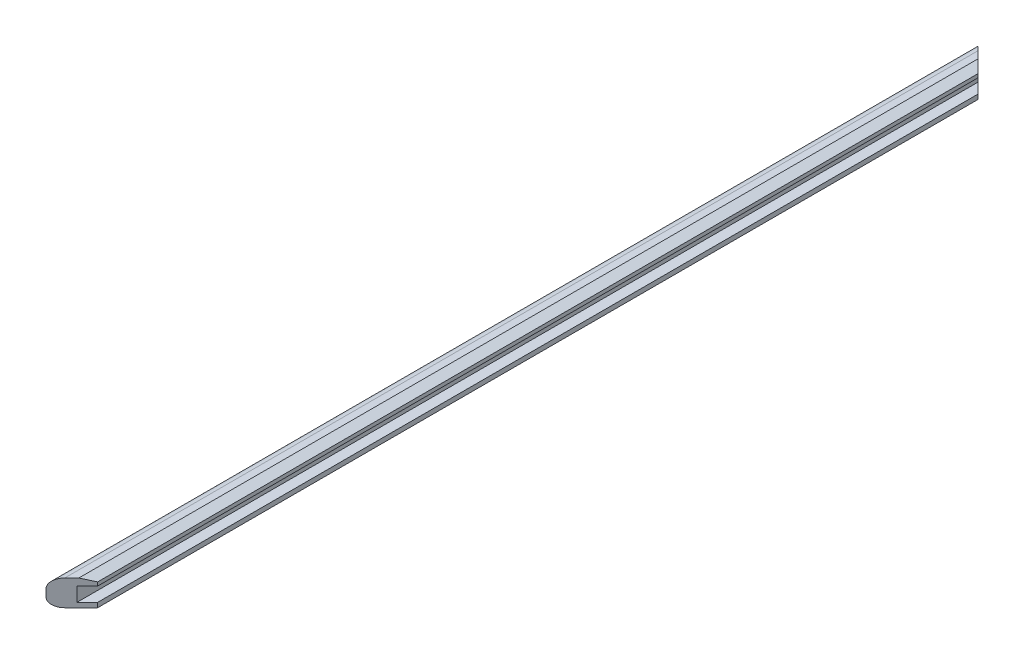
from build123d import *

# Parameters (mm, degrees)
SKETCH1_W           = 34.925
SKETCH1_H           = 34.925
BOSS_EXTRUDE1_DEPTH = 1320.8
SKETCH2_W           = 13.97
SKETCH2_H           = 19.05
CUT_EXTRUDE1_DEPTH  = 1322.030854224
FILLET1_R           = 12.7
CHAMFER1_SIZE       = 12.7
CHAMFER1_SIZE2      = 4.622421975
CUT_EXTRUDE2_DEPTH  = 1322.377059938


with BuildPart() as part:
    # Sketch1 → Boss-Extrude1 (new body)
    with BuildSketch(Plane.XY):
        Rectangle(SKETCH1_W, SKETCH1_H)
    extrude(amount=-BOSS_EXTRUDE1_DEPTH)

    # Sketch2 → Cut-Extrude1 (cut, through all)
    with BuildSketch(Plane.XY):
        with Locations((10.4775, -1.5875)):
            Rectangle(SKETCH2_W, SKETCH2_H)
    extrude(amount=-CUT_EXTRUDE1_DEPTH, mode=Mode.SUBTRACT)

    # Fillet1
    fillet1_edges = [part.edges().sort_by_distance(p)[0] for p in [
        (-17.4625, -17.4625, -660.4),
        (-17.4625, 17.4625, -660.4),
    ]]
    fillet(fillet1_edges, radius=FILLET1_R)

    # Chamfer1
    chamfer1_edges = [part.edges().sort_by_distance(p)[0] for p in [
        (17.4625, 17.4625, -660.4),
    ]]
    chamfer1_side = [part.faces().sort_by_distance(p)[0] for p in [
        (6.35, 17.4625, -660.4),
    ]]
    chamfer(chamfer1_edges, length=CHAMFER1_SIZE, length2=CHAMFER1_SIZE2, reference=chamfer1_side[0])

    # Sketch3 → Cut-Extrude2 (cut, through all)
    with BuildSketch(Plane(origin=(0, 17.4625, 0), x_dir=(1, 0, 0), z_dir=(0, 1, 0))):
        Polygon((-17.4625, 0), (17.4625, 34.925), (17.4625, 0), align=None)
        Polygon((-17.4625, 1261.11), (17.4625, 1226.185), (17.4625, 1320.8), (-17.4625, 1320.8), align=None)
    extrude(amount=-CUT_EXTRUDE2_DEPTH, mode=Mode.SUBTRACT)


solid = part.part
